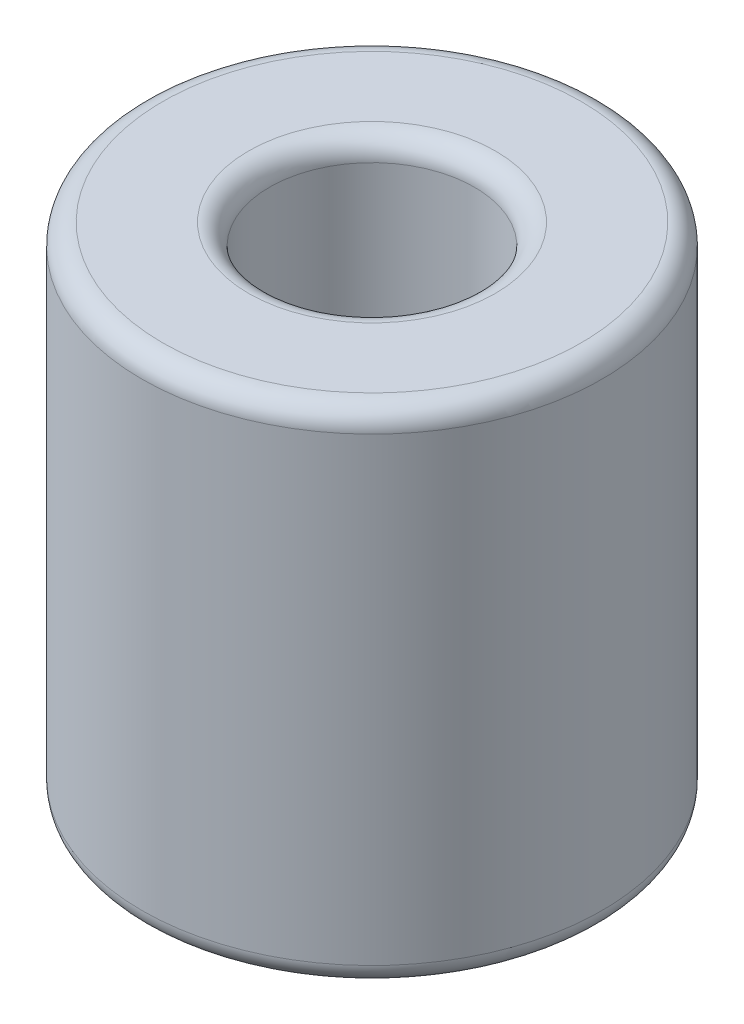
from build123d import *

# Parameters (mm, degrees)
SKETCH1_R           = 5.5
SKETCH1_R_2         = 2.45
BOSS_EXTRUDE1_DEPTH = 12
FILLET1_R           = 0.5


with BuildPart() as part:
    # Sketch1 → Boss-Extrude1 (new body)
    with BuildSketch(Plane(origin=(0, 0, 0), x_dir=(1, 0, 0), z_dir=(0, 1, 0))):
        with Locations(Location((0, 0, 0), (0, 0, 270))):
            Circle(SKETCH1_R)
        with Locations(Location((0, 0, 0), (0, 0, 270))):
            Circle(SKETCH1_R_2, mode=Mode.SUBTRACT)
    extrude(amount=BOSS_EXTRUDE1_DEPTH)

    # Fillet1
    fillet1_edges = [part.edges().sort_by_distance(p)[0] for p in [
        (0, 0, -5.5),
        (0, 12, -5.5),
        (0, 0, -2.45),
        (0, 12, -2.45),
    ]]
    fillet(fillet1_edges, radius=FILLET1_R)


solid = part.part
